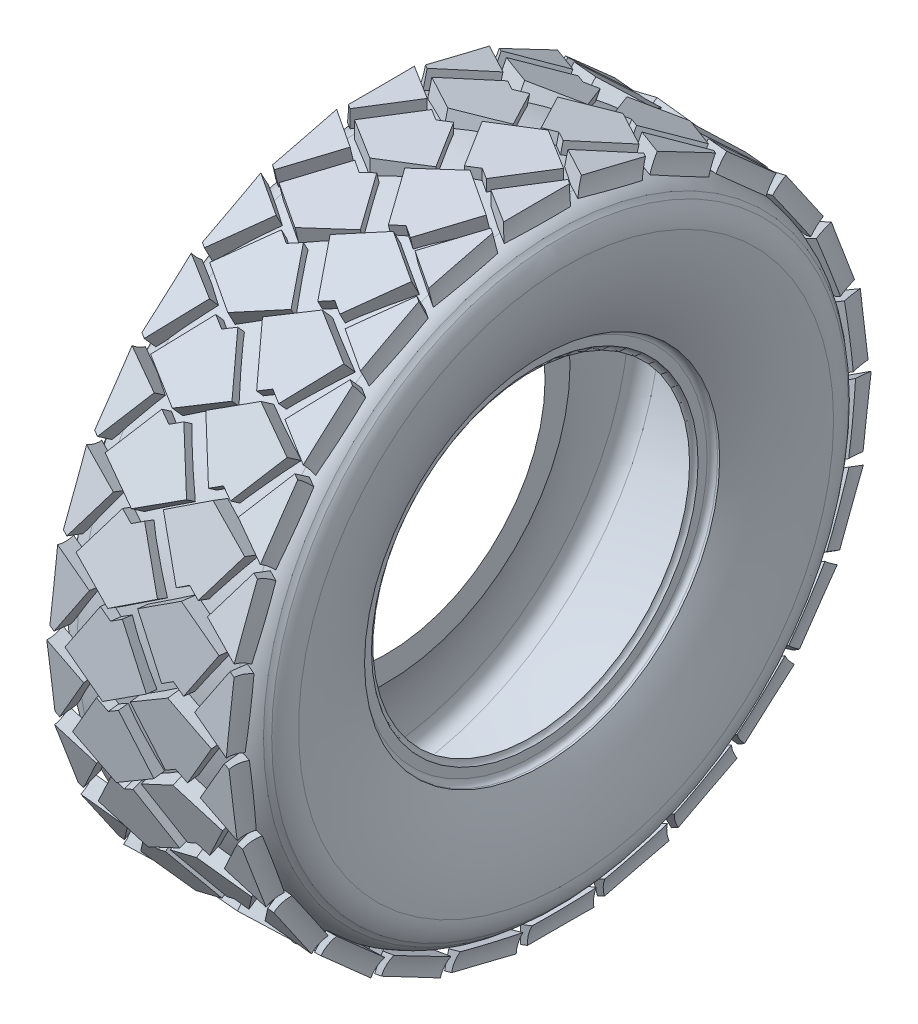
from build123d import *

# Parameters (mm, degrees)
BOSS_EXTRUDE4_DEPTH   = 20
BOSS_EXTRUDE4_2_DEPTH = 20
BOSS_EXTRUDE4_3_DEPTH = 20
BOSS_EXTRUDE4_4_DEPTH = 20
CIRPATTERN1_COUNT     = 26
CIRPATTERN1_2_COUNT   = 26
CIRPATTERN1_3_COUNT   = 26
CIRPATTERN1_4_COUNT   = 26


with BuildPart() as part:
    # Sketch1 → Revolve1 (revolve)
    with BuildSketch(Plane.XY, mode=Mode.PRIVATE) as revolve1_sk:
        with BuildLine():
            Line((95, 203), (92.604166667, 203))
            ThreePointArc((92.604166667, 203), (88.36152598, 201.242640687), (86.604166667, 197))
            Line((86.604166667, 197), (86.604166667, 186.656854249))
            ThreePointArc((86.604166667, 186.656854249), (83.705187181, 184.464101615), (82.604166667, 181))
            Line((82.604166667, 181), (82.604166667, 209.507174193))
            ThreePointArc((82.604166667, 209.507174193), (100.475791263, 254.864419749), (108.204539632, 302.999034516))
            ThreePointArc((108.204539632, 302.999034516), (104.049953739, 316.258652062), (92.259485041, 323.61139912))
            ThreePointArc((92.259485041, 323.61139912), (0, 333), (-92.259485041, 323.61139912))
            ThreePointArc((-92.259485041, 323.61139912), (-104.049953739, 316.258652062), (-108.204539632, 302.999034516))
            ThreePointArc((-108.204539632, 302.999034516), (-100.475791263, 254.864419749), (-82.604166667, 209.507174193))
            Line((-82.604166667, 209.507174193), (-82.604166667, 181))
            ThreePointArc((-82.604166667, 181), (-83.705187181, 184.464101615), (-86.604166667, 186.656854249))
            Line((-86.604166667, 186.656854249), (-86.604166667, 197))
            ThreePointArc((-86.604166667, 197), (-88.36152598, 201.242640687), (-92.604166667, 203))
            Line((-92.604166667, 203), (-95, 203))
            ThreePointArc((-95, 203), (-114.431670094, 252.844990616), (-122.33878076, 305.756147219))
            ThreePointArc((-122.33878076, 305.756147219), (-113.645914466, 332.152855083), (-89.853437055, 346.514962487))
            ThreePointArc((-89.853437055, 346.514962487), (0, 355), (89.853437055, 346.514962487))
            ThreePointArc((89.853437055, 346.514962487), (113.645914466, 332.152855083), (122.33878076, 305.756147219))
            ThreePointArc((122.33878076, 305.756147219), (114.431670094, 252.844990616), (95, 203))
        make_face()
    revolve(revolve1_sk.sketch.rotate(Axis((165.176095699, 0, 0), (-1, 0, 0)), 90), axis=Axis((165.176095699, 0, 0), (-1, 0, 0)))


with BuildPart() as body_2:
    # Sketch3 → Boss-Extrude4 (new body)
    with BuildSketch(Plane(origin=(0, 345, 0), x_dir=(1, 0, 0), z_dir=(0, 1, 0))):
        Polygon((-24.627515293, 18.560984326), (9.287317618, -35.714093828), (-37.214781738, -64.771830515), (-83.716881095, -35.714093828), (-49.802048184, 18.560984326), (-37.214781738, 10.6955873), align=None)
    extrude(amount=BOSS_EXTRUDE4_DEPTH)

    # CirPattern1 3: body 2 ×26 about axis
    cirpattern1_3_axis = Axis((0, 0, 0), (1, 0, 0))


with BuildPart() as body_3:
    # Sketch3 → Boss-Extrude4 2 (new body)
    with BuildSketch(Plane(origin=(0, 345, 0), x_dir=(1, 0, 0), z_dir=(0, 1, 0))):
        Polygon((-63.370817722, 27.039692554), (-122.365650633, 63.903755561), (-122.365650633, -11.563662254), (-97.285650633, -27.2353856), align=None)
    extrude(amount=BOSS_EXTRUDE4_2_DEPTH)

    # CirPattern1 4: body 3 ×26 about axis
    cirpattern1_4_axis = Axis((0, 0, 0), (1, 0, 0))


with BuildPart() as body_4:
    # Sketch3 → Boss-Extrude4 3 (new body)
    with BuildSketch(Plane(origin=(0, 345, 0), x_dir=(1, 0, 0), z_dir=(0, 1, 0))):
        Polygon((-9.287317612, 35.714093828), (37.214781741, 64.771830513), (83.716881095, 35.714093828), (49.802048184, -18.560984326), (37.214781741, -10.695587302), (24.627515299, -18.560984326), align=None)
    extrude(amount=BOSS_EXTRUDE4_3_DEPTH)

    # CirPattern1 2: body 4 ×26 about axis
    cirpattern1_2_axis = Axis((0, 0, 0), (1, 0, 0))


with BuildPart() as body_5:
    # Sketch3 → Boss-Extrude4 4 (new body)
    with BuildSketch(Plane(origin=(0, 345, 0), x_dir=(1, 0, 0), z_dir=(0, 1, 0))):
        Polygon((122.365650633, 11.563662254), (97.285650633, 27.2353856), (63.370817722, -27.039692554), (122.365650633, -63.903755561), align=None)
    extrude(amount=BOSS_EXTRUDE4_4_DEPTH)

    # CirPattern1: body 5 ×26 about axis
    cirpattern1_axis = Axis((0, 0, 0), (1, 0, 0))


with BuildPart() as body_5_1:
    add(body_5.part)
    for i in range(1, CIRPATTERN1_COUNT):
        add(body_5.part.rotate(cirpattern1_axis, i * 360 / CIRPATTERN1_COUNT))


with BuildPart() as body_4_1:
    add(body_4.part)
    for i in range(1, CIRPATTERN1_2_COUNT):
        add(body_4.part.rotate(cirpattern1_2_axis, i * 360 / CIRPATTERN1_2_COUNT))


with BuildPart() as body_2_1:
    add(body_2.part)
    for i in range(1, CIRPATTERN1_3_COUNT):
        add(body_2.part.rotate(cirpattern1_3_axis, i * 360 / CIRPATTERN1_3_COUNT))


with BuildPart() as body_3_1:
    add(body_3.part)
    for i in range(1, CIRPATTERN1_4_COUNT):
        add(body_3.part.rotate(cirpattern1_4_axis, i * 360 / CIRPATTERN1_4_COUNT))


with BuildPart() as cut_revolve1_tool:
    # Sketch6 → Cut-Revolve1 (revolve)
    with BuildSketch(Plane.XY):
        with BuildLine():
            ThreePointArc((-105.110376947, 379.739654327), (-109.117179675, 338.241190822), (-143.344799201, 314.436842418))
            Line((-143.344799201, 314.436842418), (-143.344799201, 379.739654327))
            Line((-143.344799201, 379.739654327), (-105.110376947, 379.739654327))
        make_face()
    revolve(axis=Axis((-280.333217772, 0, 0), (1, 0, 0)))


with BuildPart() as part_1:
    add(part.part)

    # Cut-Revolve1: cut by cut_revolve1_tool
    add(cut_revolve1_tool.part, mode=Mode.SUBTRACT)


with BuildPart() as body_3_2:
    add(body_3_1.part)

    # Cut-Revolve1: cut by cut_revolve1_tool
    add(cut_revolve1_tool.part, mode=Mode.SUBTRACT)


with BuildPart() as cut_revolve2_tool:
    # Sketch6<3> → Cut-Revolve2 (revolve)
    with BuildSketch(Plane.XY):
        with BuildLine():
            Line((143.344799201, 379.739654327), (105.110376947, 379.739654327))
            ThreePointArc((105.110376947, 379.739654327), (109.117179675, 338.241190822), (143.344799201, 314.436842418))
            Line((143.344799201, 314.436842418), (143.344799201, 379.739654327))
        make_face()
    revolve(axis=Axis((-280.333217772, 0, 0), (1, 0, 0)))


with BuildPart() as part_2:
    add(part_1.part)

    # Cut-Revolve2: cut by cut_revolve2_tool
    add(cut_revolve2_tool.part, mode=Mode.SUBTRACT)


with BuildPart() as body_5_2:
    add(body_5_1.part)

    # Cut-Revolve2: cut by cut_revolve2_tool
    add(cut_revolve2_tool.part, mode=Mode.SUBTRACT)


solid = Compound([body_4_1.part, body_2_1.part, body_3_2.part, part_2.part, body_5_2.part])
